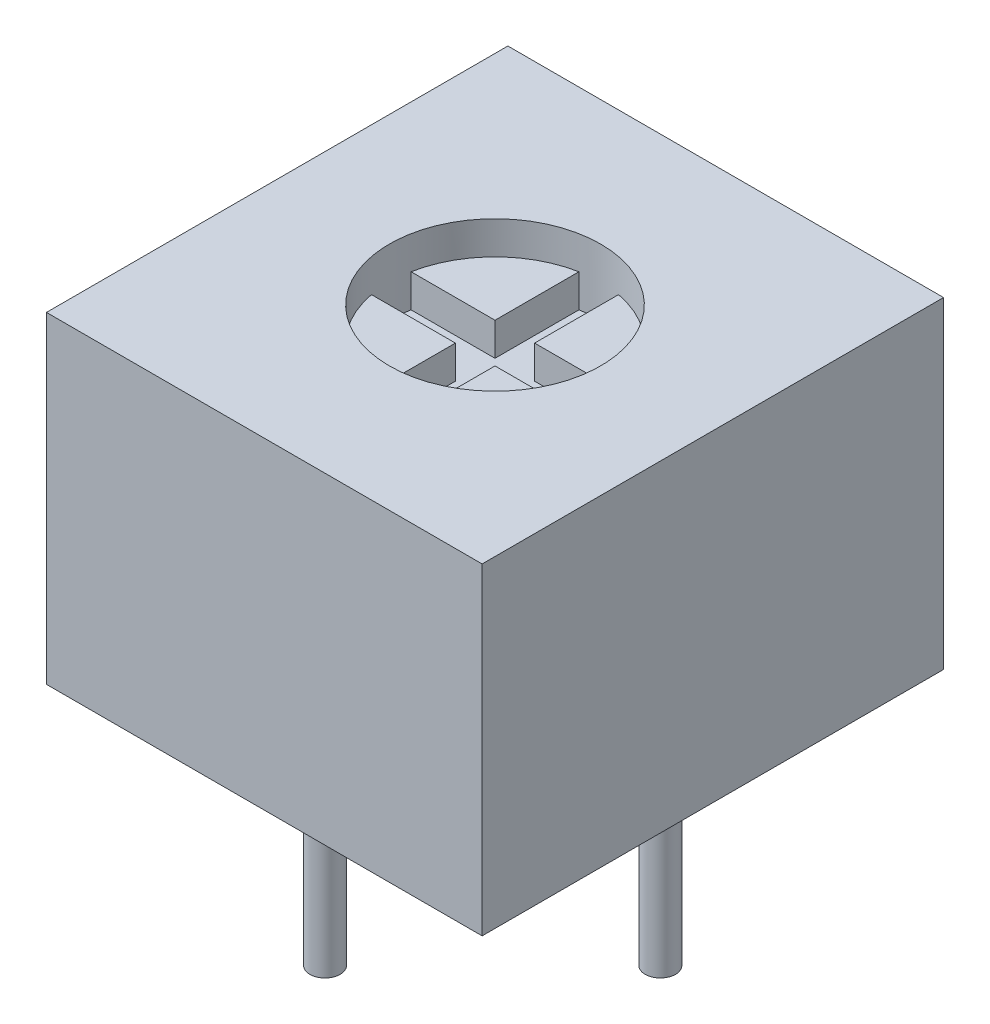
from build123d import *

# Parameters (mm, degrees)
SKETCH_1_W          = 6.6
SKETCH_1_H          = 6.99
SKETCH_1_R          = 1.6
EXTRUDE_1_DEPTH     = 4.88
CUT_EXTRUDE_START   = 4.88
CUT_EXTRUDE_1_DEPTH = 1
CUT_EXTRUDE_2_DEPTH = 0.5
SKETCH_2_R          = 0.23
EXTRUDE_2_DEPTH     = 2.5


with BuildPart() as part:
    # Эскиз1 → Бобышка-Вытянуть1 (new body)
    # profile 1 of 6: a face of its own
    with BuildSketch(Plane(origin=(0, 0, 0), x_dir=(1, 0, 0), z_dir=(0, 1, 0))):
        Rectangle(SKETCH_1_W, SKETCH_1_H)
        Circle(SKETCH_1_R, mode=Mode.SUBTRACT)
    # profile 2 of 6: a face of its own
    with BuildSketch(Plane(origin=(0, 0, 0), x_dir=(1, 0, 0), z_dir=(0, 1, 0))):
        with BuildLine():
            ThreePointArc((0.3, 1.571623365), (0, 1.6), (-0.3, 1.571623365))
            Line((-0.3, 1.571623365), (-0.3, 0.3))
            Line((-0.3, 0.3), (-1.571623365, 0.3))
            ThreePointArc((-1.571623365, 0.3), (-1.6, 0), (-1.571623365, -0.3))
            Line((-1.571623365, -0.3), (-0.3, -0.3))
            Line((-0.3, -0.3), (-0.3, -1.571623365))
            ThreePointArc((-0.3, -1.571623365), (0, -1.6), (0.3, -1.571623365))
            Line((0.3, -1.571623365), (0.3, -0.3))
            Line((0.3, -0.3), (1.571623365, -0.3))
            ThreePointArc((1.571623365, -0.3), (1.592890044, -0.150669534), (1.6, 0))
            ThreePointArc((1.6, 0), (1.592890044, 0.150669534), (1.571623365, 0.3))
            Line((1.571623365, 0.3), (0.3, 0.3))
            Line((0.3, 0.3), (0.3, 1.571623365))
        make_face()
    # profile 3 of 6: a face of its own
    with BuildSketch(Plane(origin=(0, 0, 0), x_dir=(1, 0, 0), z_dir=(0, 1, 0))):
        with BuildLine():
            ThreePointArc((0.3, -1.571623365), (1.13137085, -1.13137085), (1.571623365, -0.3))
            Line((1.571623365, -0.3), (0.3, -0.3))
            Line((0.3, -0.3), (0.3, -1.571623365))
        make_face()
    # profile 4 of 6: a face of its own
    with BuildSketch(Plane(origin=(0, 0, 0), x_dir=(1, 0, 0), z_dir=(0, 1, 0))):
        with BuildLine():
            Line((-0.3, -0.3), (-1.571623365, -0.3))
            ThreePointArc((-1.571623365, -0.3), (-1.13137085, -1.13137085), (-0.3, -1.571623365))
            Line((-0.3, -1.571623365), (-0.3, -0.3))
        make_face()
    # profile 5 of 6: a face of its own
    with BuildSketch(Plane(origin=(0, 0, 0), x_dir=(1, 0, 0), z_dir=(0, 1, 0))):
        with BuildLine():
            Line((-0.3, 0.3), (-0.3, 1.571623365))
            ThreePointArc((-0.3, 1.571623365), (-1.13137085, 1.13137085), (-1.571623365, 0.3))
            Line((-1.571623365, 0.3), (-0.3, 0.3))
        make_face()
    # profile 6 of 6: a face of its own
    with BuildSketch(Plane(origin=(0, 0, 0), x_dir=(1, 0, 0), z_dir=(0, 1, 0))):
        with BuildLine():
            ThreePointArc((1.571623365, 0.3), (1.13137085, 1.13137085), (0.3, 1.571623365))
            Line((0.3, 1.571623365), (0.3, 0.3))
            Line((0.3, 0.3), (1.571623365, 0.3))
        make_face()
    extrude(amount=EXTRUDE_1_DEPTH)

    # Эскиз1<3> → Вырез-Вытянуть1 (cut)
    with BuildSketch(Plane(origin=(0, 0, 0), x_dir=(1, 0, 0), z_dir=(0, 1, 0)).offset(CUT_EXTRUDE_START)):
        with BuildLine():
            ThreePointArc((0.3, 1.571623365), (0, 1.6), (-0.3, 1.571623365))
            Line((-0.3, 1.571623365), (-0.3, 0.3))
            Line((-0.3, 0.3), (-1.571623365, 0.3))
            ThreePointArc((-1.571623365, 0.3), (-1.6, 0), (-1.571623365, -0.3))
            Line((-1.571623365, -0.3), (-0.3, -0.3))
            Line((-0.3, -0.3), (-0.3, -1.571623365))
            ThreePointArc((-0.3, -1.571623365), (0, -1.6), (0.3, -1.571623365))
            Line((0.3, -1.571623365), (0.3, -0.3))
            Line((0.3, -0.3), (1.571623365, -0.3))
            ThreePointArc((1.571623365, -0.3), (1.592890044, -0.150669534), (1.6, 0))
            ThreePointArc((1.6, 0), (1.592890044, 0.150669534), (1.571623365, 0.3))
            Line((1.571623365, 0.3), (0.3, 0.3))
            Line((0.3, 0.3), (0.3, 1.571623365))
        make_face()
    extrude(amount=-CUT_EXTRUDE_1_DEPTH, mode=Mode.SUBTRACT)

    # Эскиз1<4> → Вырез-Вытянуть2 (cut)
    with BuildSketch(Plane(origin=(0, 0, 0), x_dir=(1, 0, 0), z_dir=(0, 1, 0)).offset(CUT_EXTRUDE_START)):
        with BuildLine():
            Line((-0.3, -0.3), (-1.571623365, -0.3))
            ThreePointArc((-1.571623365, -0.3), (-1.13137085, -1.13137085), (-0.3, -1.571623365))
            Line((-0.3, -1.571623365), (-0.3, -0.3))
        make_face()
        with BuildLine():
            Line((-0.3, 0.3), (-0.3, 1.571623365))
            ThreePointArc((-0.3, 1.571623365), (-1.13137085, 1.13137085), (-1.571623365, 0.3))
            Line((-1.571623365, 0.3), (-0.3, 0.3))
        make_face()
        with BuildLine():
            ThreePointArc((1.571623365, 0.3), (1.13137085, 1.13137085), (0.3, 1.571623365))
            Line((0.3, 1.571623365), (0.3, 0.3))
            Line((0.3, 0.3), (1.571623365, 0.3))
        make_face()
        with BuildLine():
            ThreePointArc((0.3, -1.571623365), (1.13137085, -1.13137085), (1.571623365, -0.3))
            Line((1.571623365, -0.3), (0.3, -0.3))
            Line((0.3, -0.3), (0.3, -1.571623365))
        make_face()
    extrude(amount=-CUT_EXTRUDE_2_DEPTH, mode=Mode.SUBTRACT)

    # Эскиз2 → Бобышка-Вытянуть2 (add)
    with BuildSketch(Plane.XZ):
        with Locations(Location((0, 2.575, 0), (0, 0, 90))):
            Circle(SKETCH_2_R)
        with Locations(Location((2.54, 0.035, 0), (0, 0, 90))):
            Circle(SKETCH_2_R)
        with Locations(Location((-2.54, 0.035, 0), (0, 0, 90))):
            Circle(SKETCH_2_R)
    extrude(amount=EXTRUDE_2_DEPTH)


solid = part.part
